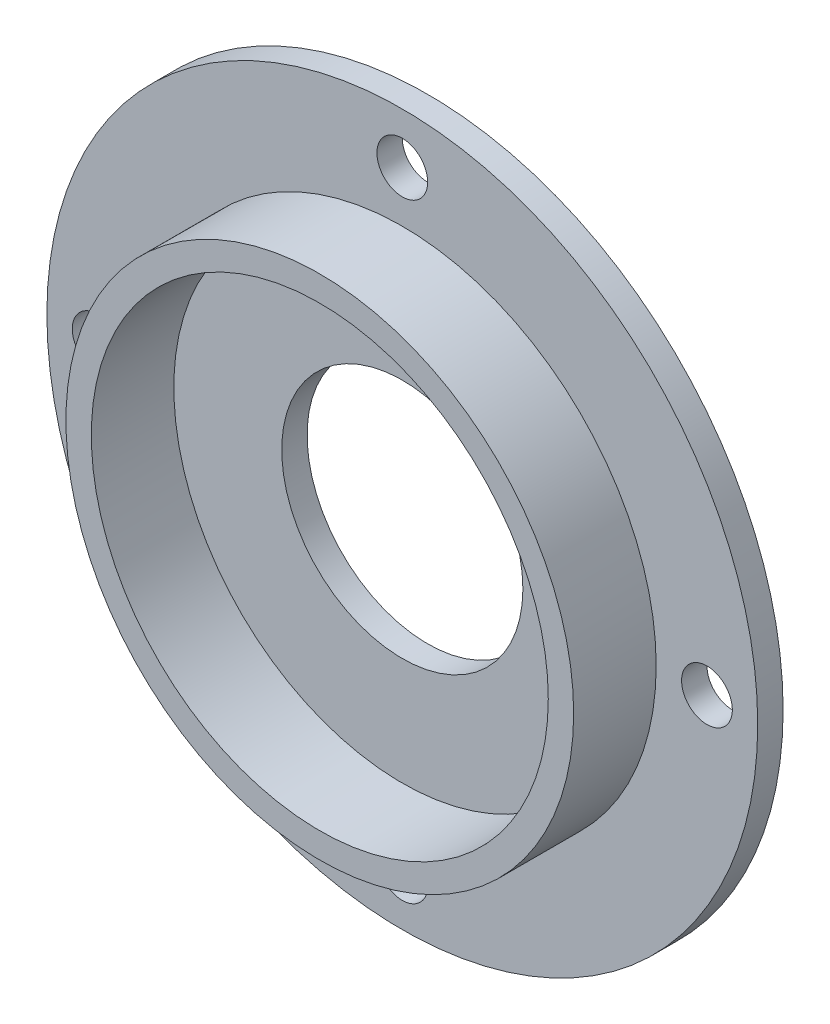
from build123d import *

# Parameters (mm, degrees)
SKETCH_1_R      = 140
SKETCH_1_R_2    = 47.5
SKETCH_1_R_3    = 10
EXTRUDE_1_DEPTH = 10
SKETCH_2_R      = 100
SKETCH_2_R_2    = 90
EXTRUDE_2_DEPTH = 32.5


with BuildPart() as part:
    # 草图1 → 拉伸1 (new body)
    with BuildSketch(Plane.XY):
        Circle(SKETCH_1_R)
        Circle(SKETCH_1_R_2, mode=Mode.SUBTRACT)
        with Locations((0, 120)):
            Circle(SKETCH_1_R_3, mode=Mode.SUBTRACT)
        with Locations((120, 0)):
            Circle(SKETCH_1_R_3, mode=Mode.SUBTRACT)
        with Locations((0, -120)):
            Circle(SKETCH_1_R_3, mode=Mode.SUBTRACT)
        with Locations((-120, 0)):
            Circle(SKETCH_1_R_3, mode=Mode.SUBTRACT)
    extrude(amount=EXTRUDE_1_DEPTH)

    # 草图2 → 拉伸2 (add)
    with BuildSketch(Plane.XY.offset(10)):
        Circle(SKETCH_2_R)
        Circle(SKETCH_2_R_2, mode=Mode.SUBTRACT)
    extrude(amount=EXTRUDE_2_DEPTH)


solid = part.part
